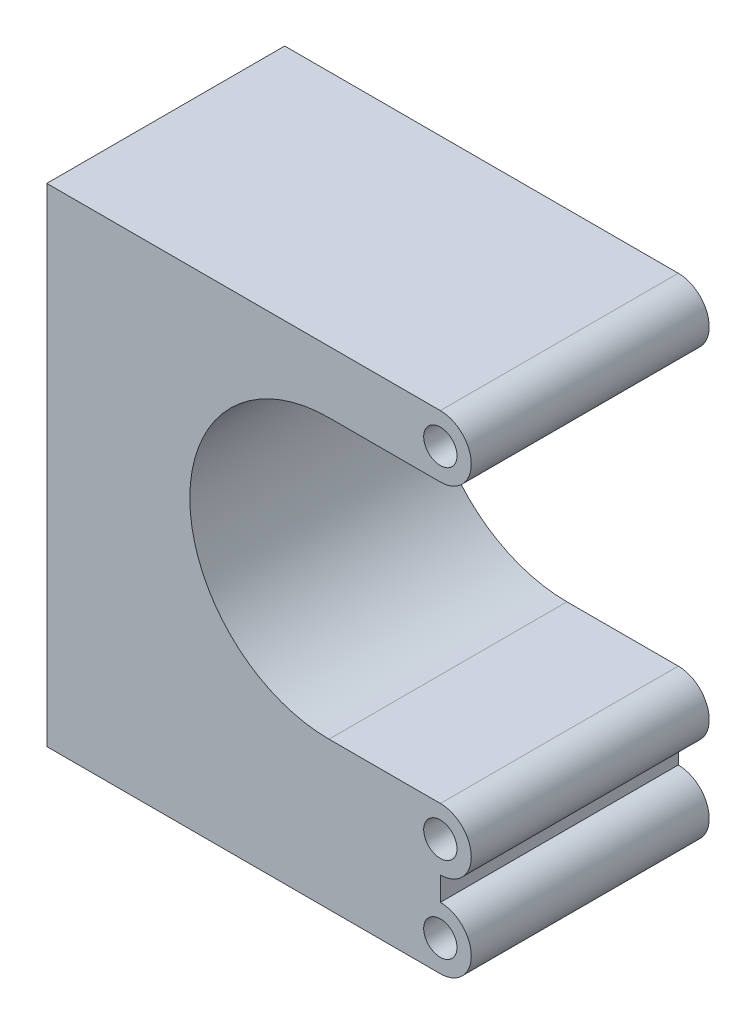
from build123d import *

# Parameters (mm, degrees)
BOSS_EXTRUDE1_DEPTH = 25.4
SKETCH4_R           = 3.302
BOSS_EXTRUDE2_DEPTH = 25.4
SKETCH6_R           = 1.778
CUT_EXTRUDE1_DEPTH  = 74.551770003


with BuildPart() as part:
    # Sketch3 → Boss-Extrude1 (new body)
    with BuildSketch(Plane.XY):
        with BuildLine():
            Line((42.012655142, -6.604), (30.128190046, -6.604))
            ThreePointArc((30.128190046, -6.604), (15.269190046, -21.463), (30.128190046, -36.322))
            Line((30.128190046, -36.322), (42.012655142, -36.322))
            Line((42.012655142, -36.322), (42.012655142, -52.07))
            Line((42.012655142, -52.07), (0, -52.07))
            Line((0, -52.07), (0, 0))
            Line((0, 0), (42.012655142, 0))
            Line((42.012655142, 0), (42.012655142, -6.604))
        make_face()
    extrude(amount=BOSS_EXTRUDE1_DEPTH)

    # Sketch4 → Boss-Extrude2 (add)
    with BuildSketch(Plane.XY.offset(25.4)):
        with Locations((42.012655142, -3.302)):
            Circle(SKETCH4_R)
        with Locations((42.012655142, -39.624)):
            Circle(SKETCH4_R)
        with Locations((42.012655142, -48.768)):
            Circle(SKETCH4_R)
    extrude(amount=-BOSS_EXTRUDE2_DEPTH)

    # Sketch6 → Cut-Extrude1 (cut, through all)
    with BuildSketch(Plane.XY.offset(25.4)):
        with Locations((42.012655142, -3.302)):
            Circle(SKETCH6_R)
        with Locations((42.012655142, -39.624)):
            Circle(SKETCH6_R)
        with Locations((42.012655142, -48.768)):
            Circle(SKETCH6_R)
    extrude(amount=-CUT_EXTRUDE1_DEPTH, mode=Mode.SUBTRACT)


solid = part.part
